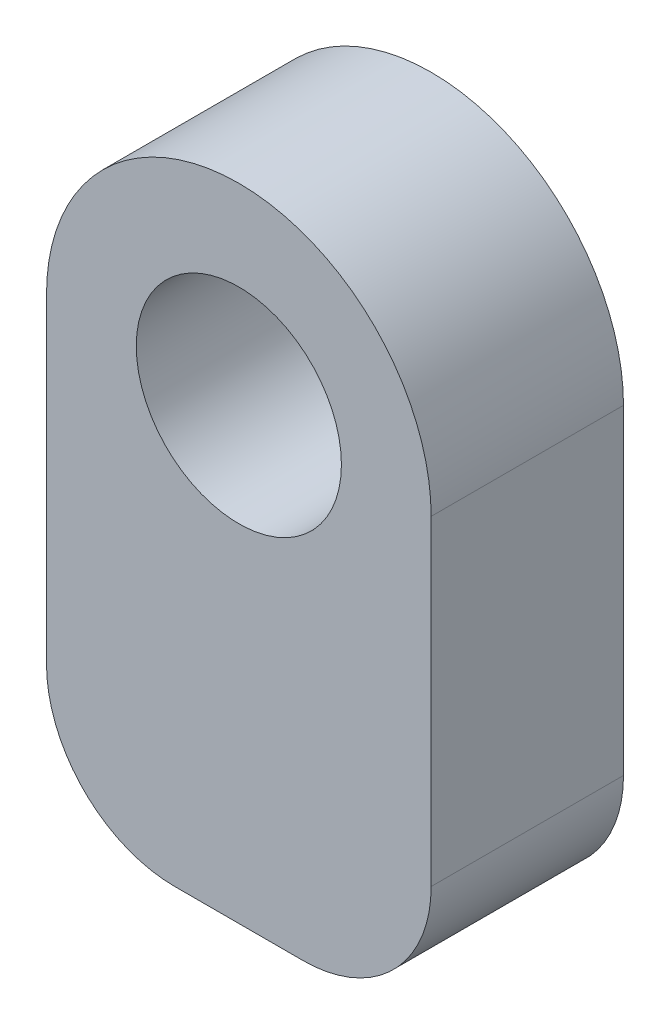
from build123d import *

# Parameters (mm, degrees)
SKETCH_1_R      = 1.6
EXTRUDE_1_DEPTH = 3
FILLET_1_R      = 2


with BuildPart() as part:
    # ｽｹｯﾁ1 → ﾎﾞｽ - 押し出し1 (new body)
    with BuildSketch(Plane.XY):
        with BuildLine():
            Line((3, -3.5), (-3, -3.5))
            Line((-3, -3.5), (-3, 3.5))
            ThreePointArc((-3, 3.5), (0, 6.5), (3, 3.5))
            Line((3, 3.5), (3, -3.5))
        make_face()
        with Locations((0, 3.5)):
            Circle(SKETCH_1_R, mode=Mode.SUBTRACT)
    extrude(amount=EXTRUDE_1_DEPTH)

    # ﾌｨﾚｯﾄ1
    fillet_1_edges = [part.edges().sort_by_distance(p)[0] for p in [
        (3, -3.5, 1.5),
        (-3, -3.5, 1.5),
    ]]
    fillet(fillet_1_edges, radius=FILLET_1_R)


solid = part.part
